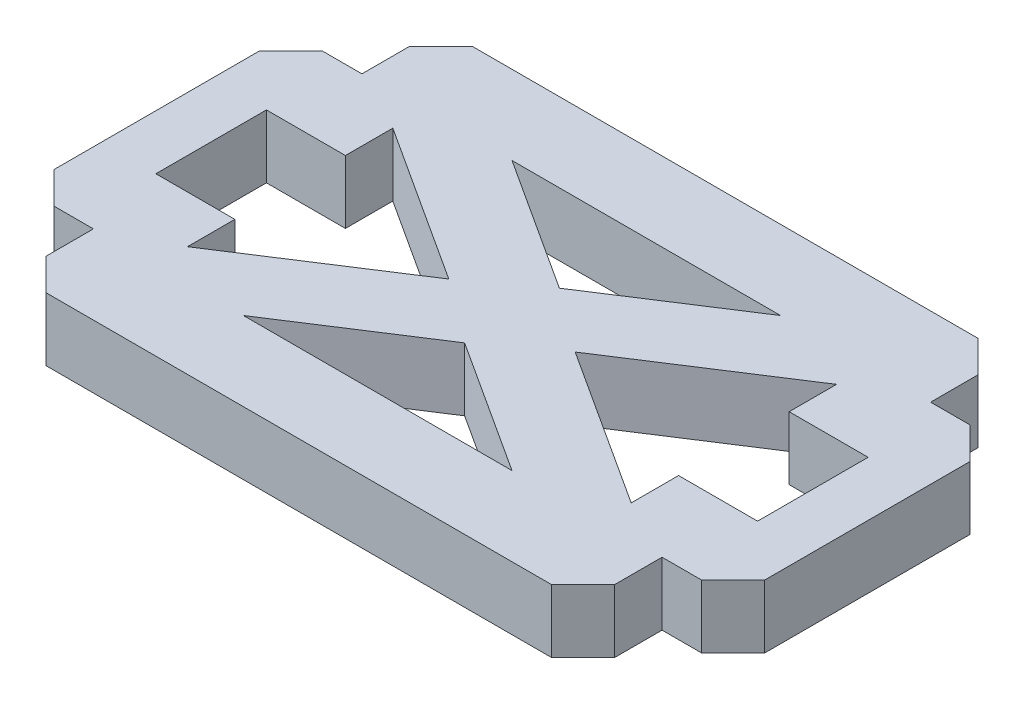
from build123d import *

# Parameters (mm, degrees)
EXTRUDE_1_DEPTH          = 2
CUT_EXTRUDE_1_DEPTH      = 27.54241888
CUT_EXTRUDE_1_DEPTH_BACK = 27.54241888
CHAMFER_1_SIZE           = 2


with BuildPart() as part:
    # 草图1 → 凸台-拉伸1 (new, symmetric)
    with BuildSketch(Plane(origin=(0, 0, 0), x_dir=(1, 0, 0), z_dir=(0, 1, 0))):
        Polygon((-18, 13.5), (-18, 8.5), (-22.5, 8.5), (-22.5, -8.5), (-18, -8.5), (-18, -13.5), (18, -13.5), (18, -8.5), (22.5, -8.5), (22.5, 8.5), (18, 8.5), (18, 13.5), align=None)
    extrude(amount=EXTRUDE_1_DEPTH, both=True)

    # 草图2 → 切除-拉伸1 (cut, two sides: drawn at the far end of the back side and taken through both)
    with BuildSketch(Plane(origin=(0, 2, 0), x_dir=(1, 0, 0), z_dir=(0, 1, 0)).offset(-CUT_EXTRUDE_1_DEPTH_BACK)):
        Polygon((0, 3), (8.5, 8.5), (-8.5, 8.5), align=None)
        Polygon((4, 0), (14.045454545, 6.5), (14.045454545, 3.5), (19.045454545, 3.5), (19.045454545, -3.5), (14.045454545, -3.5), (14.045454545, -6.5), align=None)
        Polygon((8.5, -8.5), (-8.5, -8.5), (0, -3), align=None)
        Polygon((-4, 0), (-14.045454545, -6.5), (-14.045454545, -3.5), (-19.045454545, -3.5), (-19.045454545, 3.5), (-14.045454545, 3.5), (-14.045454545, 6.5), align=None)
    extrude(amount=CUT_EXTRUDE_1_DEPTH + CUT_EXTRUDE_1_DEPTH_BACK, mode=Mode.SUBTRACT)

    # 倒角1
    chamfer_1_edges = [part.edges().sort_by_distance(p)[0] for p in [
        (22.5, 0, -8.5),
        (22.5, 0, 8.5),
        (18, 0, 13.5),
        (-18, 0, 13.5),
        (-22.5, 0, 8.5),
        (-22.5, 0, -8.5),
        (-18, 0, -13.5),
        (18, 0, -13.5),
    ]]
    chamfer(chamfer_1_edges, length=CHAMFER_1_SIZE)


solid = part.part
